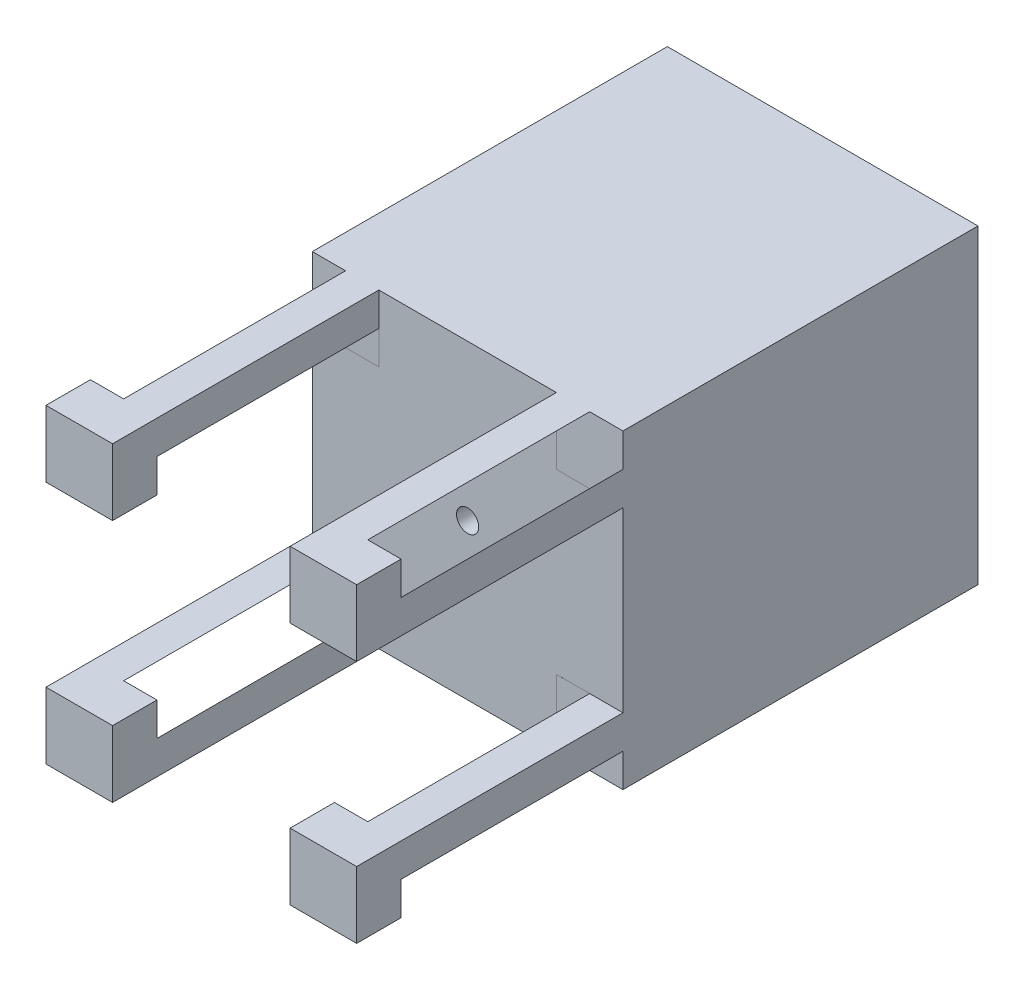
from build123d import *

# Parameters (mm, degrees)
SKETCH_1_W               = 70
SKETCH_1_H               = 70
SKETCH_1_W_2             = 40
SKETCH_1_H_2             = 40
EXTRUDE_1_DEPTH          = 80
SKETCH_3_W               = 40
SKETCH_3_H               = 40
EXTRUDE_2_DEPTH          = 15
SKETCH_4_R               = 2.5
CUT_EXTRUDE_1_DEPTH      = 15
SKETCH_5_R               = 30
CUT_EXTRUDE_3_DEPTH      = 70
EXTRUDE_START            = -10
EXTRUDE_4_DEPTH          = 10
SKETCH_8_W               = 19.934341116
SKETCH_8_H               = 60
CUT_EXTRUDE_6_DEPTH      = 35
SKETCH_9_W               = 15
SKETCH_9_H               = 15
EXTRUDE_5_DEPTH          = 0.001
EXTRUDE_6_DEPTH          = 50
SKETCH_11_W              = 15
SKETCH_11_H              = 15
EXTRUDE_7_DEPTH          = 10
PATTERN_CIRCULAR_1_COUNT = 4


with BuildPart() as part:
    # 草图1 → 凸台-拉伸1 (new body)
    with BuildSketch(Plane.XY):
        with Locations((7.829504232, -18.198307134)):
            Rectangle(SKETCH_1_W, SKETCH_1_H)
        with Locations((7.845306404, -19.744690932)):
            Rectangle(SKETCH_1_W_2, SKETCH_1_H_2, mode=Mode.SUBTRACT)
    extrude(amount=EXTRUDE_1_DEPTH)

    # 草图3 → 凸台-拉伸2 (add)
    with BuildSketch(Plane.XY.offset(80)):
        with Locations((7.845306404, -19.744690932)):
            Rectangle(SKETCH_3_W, SKETCH_3_H)
    extrude(amount=-EXTRUDE_2_DEPTH)

    # 草图4 → 切除-拉伸1 (cut)
    with BuildSketch(Plane.XY.offset(80)):
        with Locations((7.829504232, -18.198307134)):
            Circle(SKETCH_4_R)
    extrude(amount=-CUT_EXTRUDE_1_DEPTH, mode=Mode.SUBTRACT)

    # 草图5 → 切除-拉伸3 (cut)
    with BuildSketch(Plane(origin=(0, 0, 65), x_dir=(-1, 0, 0), z_dir=(0, 0, -1))):
        with Locations(Location((-7.829504232, -18.198307134, 0), (0, 0, 180))):
            Circle(SKETCH_5_R)
    extrude(amount=CUT_EXTRUDE_3_DEPTH, mode=Mode.SUBTRACT)

    # 草图7 → 凸台-拉伸4 (add)
    with BuildSketch(Plane(origin=(0, 0, 0), x_dir=(-1, 0, 0), z_dir=(0, 0, -1)).offset(EXTRUDE_START)):
        with BuildLine():
            Line((-17.829504232, 10.085964113), (-17.829504232, -46.482578382))
            ThreePointArc((-17.829504232, -46.482578382), (-37.829504232, -18.198307134), (-17.829504232, 10.085964113))
        make_face()
        with BuildLine():
            Line((2.170495768, 10.085964113), (2.170495768, -46.482578382))
            ThreePointArc((2.170495768, -46.482578382), (22.170495768, -18.198307134), (2.170495768, 10.085964113))
        make_face()
    extrude(amount=EXTRUDE_4_DEPTH)

    # 草图8 → 切除-拉伸6 (cut)
    with BuildSketch(Plane(origin=(0, 0, 0), x_dir=(-1, 0, 0), z_dir=(0, 0, -1))):
        with Locations((-7.862333674, -18.198307134)):
            Rectangle(SKETCH_8_W, SKETCH_8_H)
    extrude(amount=-CUT_EXTRUDE_6_DEPTH, mode=Mode.SUBTRACT)

    # 草图9 → 凸台-拉伸5 (add)
    with BuildSketch(Plane.XY.offset(80)):
        with Locations((-19.670495768, -45.698307134)):
            Rectangle(SKETCH_9_W, SKETCH_9_H)
    extrude_5 = extrude(amount=EXTRUDE_5_DEPTH)

    # 草图10 → 凸台-拉伸6 (add)
    with BuildSketch(Plane.XY.offset(80.001)):
        Polygon((-27.170495768, -38.198307134), (-19.670495768, -38.198307134), (-27.170495768, -45.698307134), align=None)
        Polygon((-19.670495768, -53.198307134), (-12.170495768, -53.198307134), (-12.170495768, -45.698307134), align=None)
    extrude_6 = extrude(amount=EXTRUDE_6_DEPTH)

    # 草图11 → 凸台-拉伸7 (add)
    with BuildSketch(Plane.XY.offset(130.001)):
        with Locations((-19.670495768, -45.698307134)):
            Rectangle(SKETCH_11_W, SKETCH_11_H)
    extrude_7 = extrude(amount=EXTRUDE_7_DEPTH)

    # 阵列(圆周)1: 凸台-拉伸5, 凸台-拉伸6, 凸台-拉伸7 ×4 about axis
    pattern_circular_1_axis = Axis((7.829504232, -18.198307134, 0), (0, 0, 1))
    add([extrude_5.rotate(pattern_circular_1_axis, i * 360 / PATTERN_CIRCULAR_1_COUNT) for i in range(1, PATTERN_CIRCULAR_1_COUNT)])
    add([extrude_6.rotate(pattern_circular_1_axis, i * 360 / PATTERN_CIRCULAR_1_COUNT) for i in range(1, PATTERN_CIRCULAR_1_COUNT)])
    add([extrude_7.rotate(pattern_circular_1_axis, i * 360 / PATTERN_CIRCULAR_1_COUNT) for i in range(1, PATTERN_CIRCULAR_1_COUNT)])


solid = part.part
